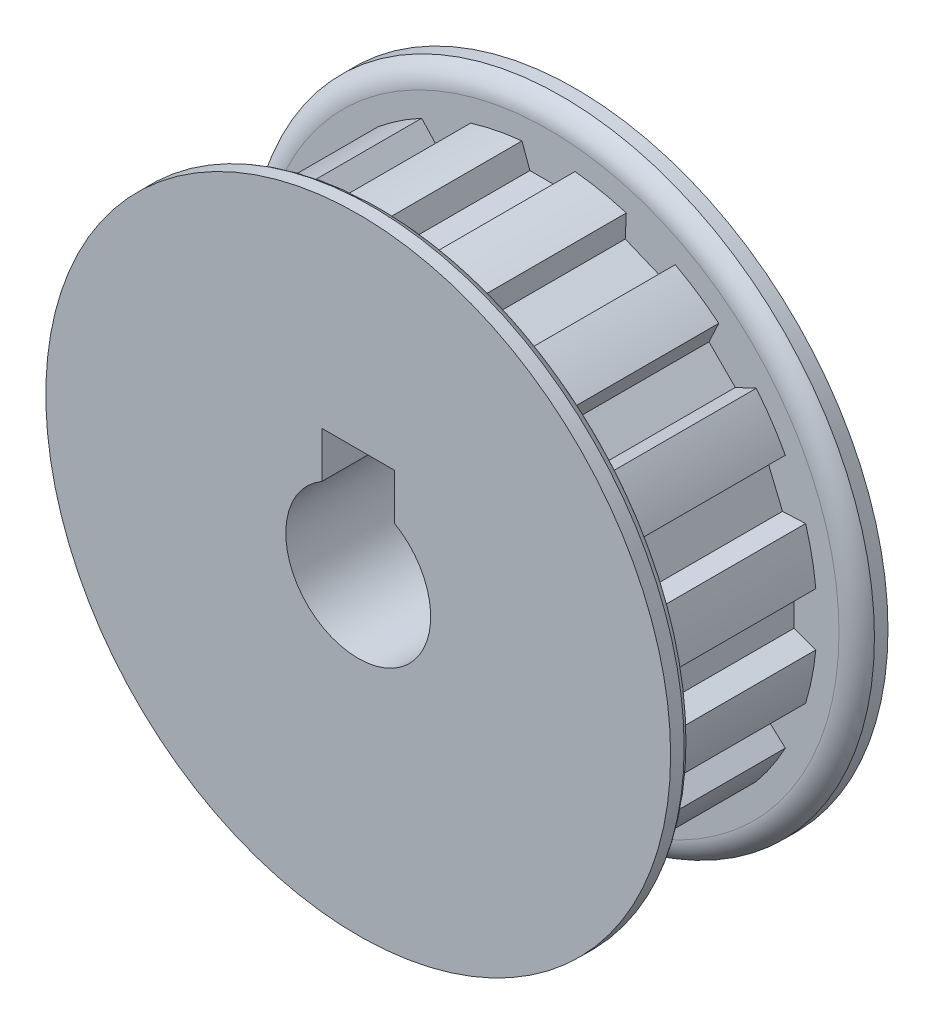
from build123d import *

# Parameters (mm, degrees)
CUT_EXTRUDE1_START      = -0.7874
CUT_EXTRUDE1_DEPTH      = 14.3002
CIRPATTERN1_COUNT       = 16
SKETCH4_R               = 3.175
CUT_EXTRUDE2_DEPTH      = 43.478219515
CUT_EXTRUDE3_START      = 1.5875
SKETCH5_R               = 30.004447146
CUT_EXTRUDE3_DEPTH      = 20.32
CUT_EXTRUDE4_DEPTH      = 20.32
CUT_EXTRUDE4_DEPTH_BACK = 20.32
SKETCH6_W               = 6.35
SKETCH6_H               = 6.35


with BuildPart() as part:
    # Sketch2 → Revolve1 (revolve)
    with BuildSketch(Plane(origin=(0, 0, 0), x_dir=(0, 0, -1), z_dir=(1, 0, 0)), mode=Mode.PRIVATE) as revolve1_sk:
        with BuildLine():
            Line((-17.4625, 6.35), (17.4625, 6.35))
            Line((17.4625, 6.35), (17.4625, 27.3812))
            Line((17.4625, 27.3812), (16.27505, 27.3812))
            ThreePointArc((16.27505, 27.3812), (15.408504076, 26.591481572), (15.0876, 25.463839073))
            Line((15.0876, 25.463839073), (15.0876, 23.546478146))
            Line((15.0876, 23.546478146), (0.7874, 23.546478146))
            Line((0.7874, 23.546478146), (0.7874, 25.463839073))
            ThreePointArc((0.7874, 25.463839073), (0.466495924, 26.591481572), (-0.40005, 27.3812))
            Line((-0.40005, 27.3812), (-1.5875, 27.3812))
            Line((-1.5875, 27.3812), (-1.5875, 18.2626))
            Line((-1.5875, 18.2626), (-17.4625, 18.2626))
            Line((-17.4625, 18.2626), (-17.4625, 6.35))
        make_face()
    revolve(revolve1_sk.sketch.rotate(Axis((0, 0, 17.4625), (0, 0, -1)), 90), axis=Axis((0, 0, 17.4625), (0, 0, -1)))

    # Sketch3 → Cut-Extrude1 (cut)
    with BuildSketch(Plane.XY.offset(CUT_EXTRUDE1_START)):
        with BuildLine():
            Line((-1.630736704, 21.5265), (1.630736704, 21.5265))
            Line((1.630736704, 21.5265), (2.3241, 23.4315))
            ThreePointArc((2.3241, 23.4315), (0, 23.546478146), (-2.3241, 23.4315))
            Line((-2.3241, 23.4315), (-1.630736704, 21.5265))
        make_face()
    cut_extrude1 = extrude(amount=-CUT_EXTRUDE1_DEPTH, mode=Mode.SUBTRACT)

    # CirPattern1: Cut-Extrude1 ×16 about axis
    cirpattern1_axis = Axis((0, 0, 0), (0, 0, 1))
    for i in range(1, CIRPATTERN1_COUNT):
        add(cut_extrude1.rotate(cirpattern1_axis, i * 360 / CIRPATTERN1_COUNT), mode=Mode.SUBTRACT)

    # Sketch4 → Cut-Extrude2 (cut, through all)
    with BuildSketch(Plane(origin=(0, 0, 0), x_dir=(0, -1, 0), z_dir=(1, 0, 0))):
        with Locations(Location((0, -9.525, 0), (0, 0, 270))):
            Circle(SKETCH4_R)
    extrude(amount=CUT_EXTRUDE2_DEPTH, mode=Mode.SUBTRACT)

    # Sketch5 → Cut-Extrude3 (cut)
    with BuildSketch(Plane.XY.offset(CUT_EXTRUDE3_START)):
        Circle(SKETCH5_R)
    extrude(amount=CUT_EXTRUDE3_DEPTH, mode=Mode.SUBTRACT)

    # Sketch6 → Cut-Extrude4 (cut, two sides: drawn at the far end of the back side and taken through both)
    with BuildSketch(Plane.XY.offset(-CUT_EXTRUDE4_DEPTH_BACK)):
        with Locations((0, 6.35)):
            Rectangle(SKETCH6_W, SKETCH6_H)
    extrude(amount=CUT_EXTRUDE4_DEPTH + CUT_EXTRUDE4_DEPTH_BACK, mode=Mode.SUBTRACT)


solid = part.part
